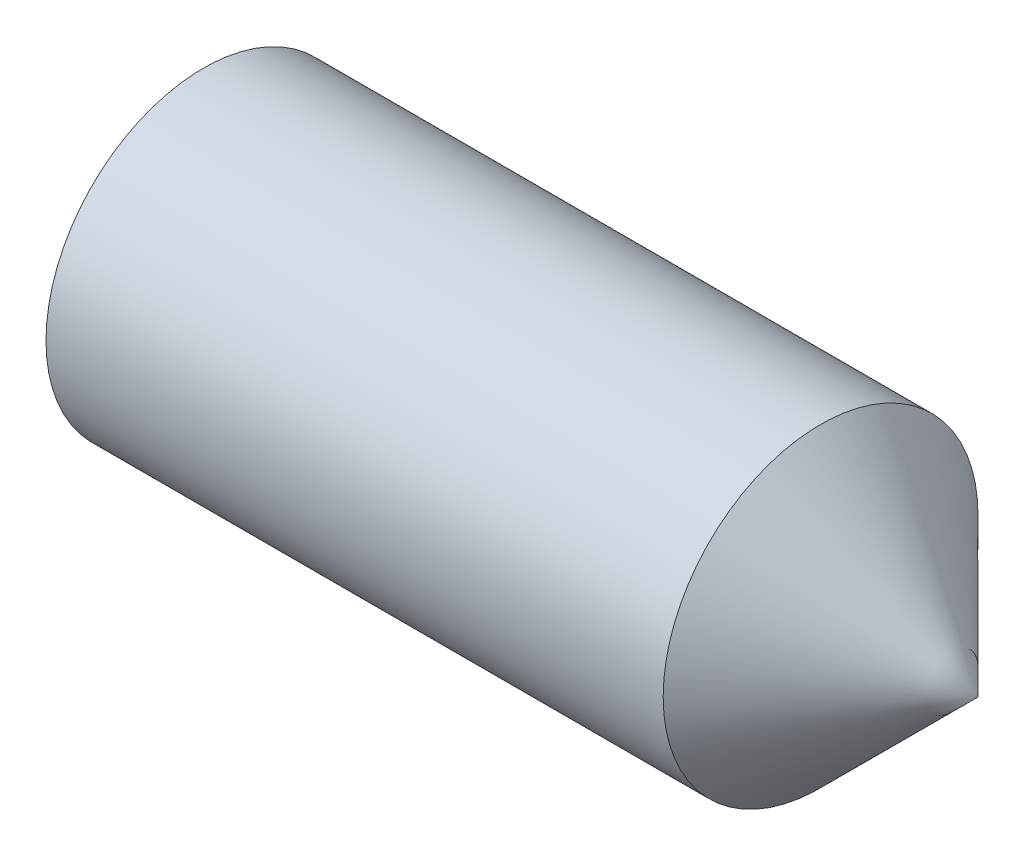
from build123d import *

# Parameters (mm, degrees)
HEX_2_DEPTH = 15


with BuildPart() as part:
    # BodySke → BaseBody (revolve)
    with BuildSketch(Plane.XY, mode=Mode.PRIVATE) as basebody_sk:
        Polygon((0, 0), (0, 10.352), (0.951473244, 12), (48, 12), (60, 0), align=None)
    revolve(basebody_sk.sketch.rotate(Axis((-12.7, 0, 0), (1, 0, 0)), 90), axis=Axis((-12.7, 0, 0), (1, 0, 0)))

    # Sketch2 → Hex 2 (cut)
    with BuildSketch(Plane.ZY):
        Polygon((3.464101615, 6), (-3.464101615, 6), (-6.92820323, 0), (-3.464101615, -6), (3.464101615, -6), (6.92820323, 0), align=None)
    extrude(amount=-HEX_2_DEPTH, mode=Mode.SUBTRACT)


solid = part.part
